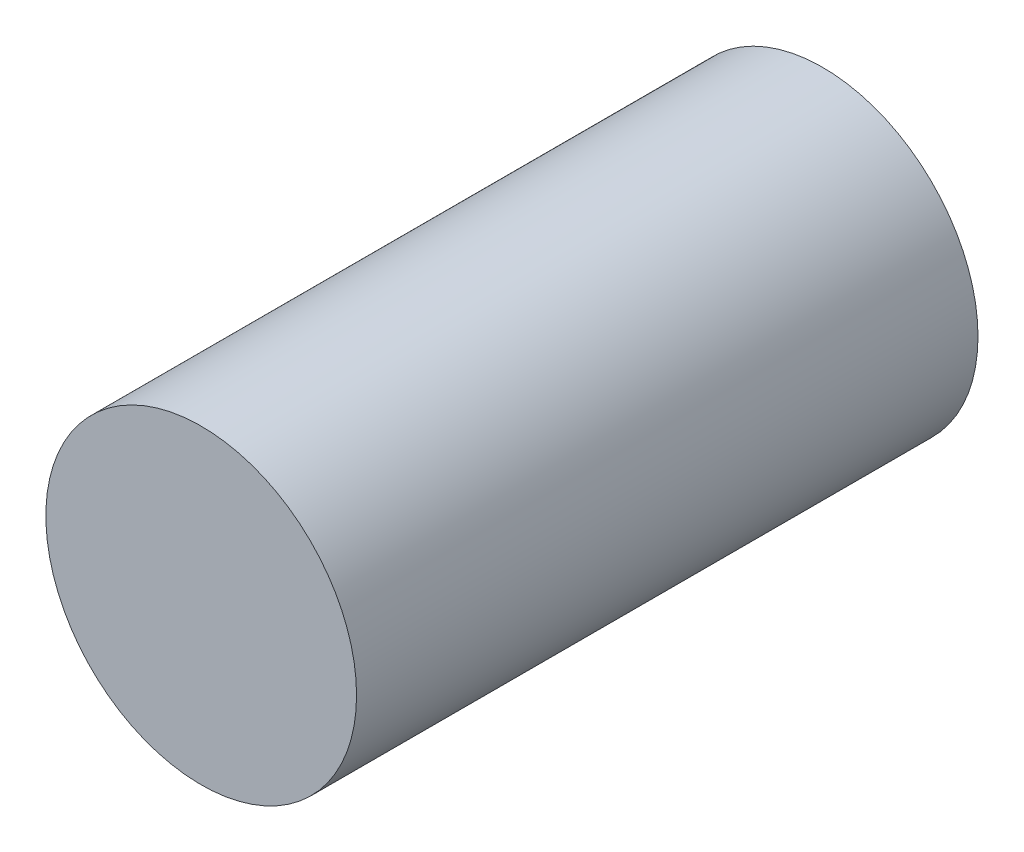
from build123d import *

# Parameters (mm, degrees)
SKETCH1_R           = 1.5875
BOSS_EXTRUDE1_DEPTH = 6.35


with BuildPart() as part:
    # Sketch1 → Boss-Extrude1 (new body)
    with BuildSketch(Plane.XY):
        Circle(SKETCH1_R)
    extrude(amount=BOSS_EXTRUDE1_DEPTH)


solid = part.part
